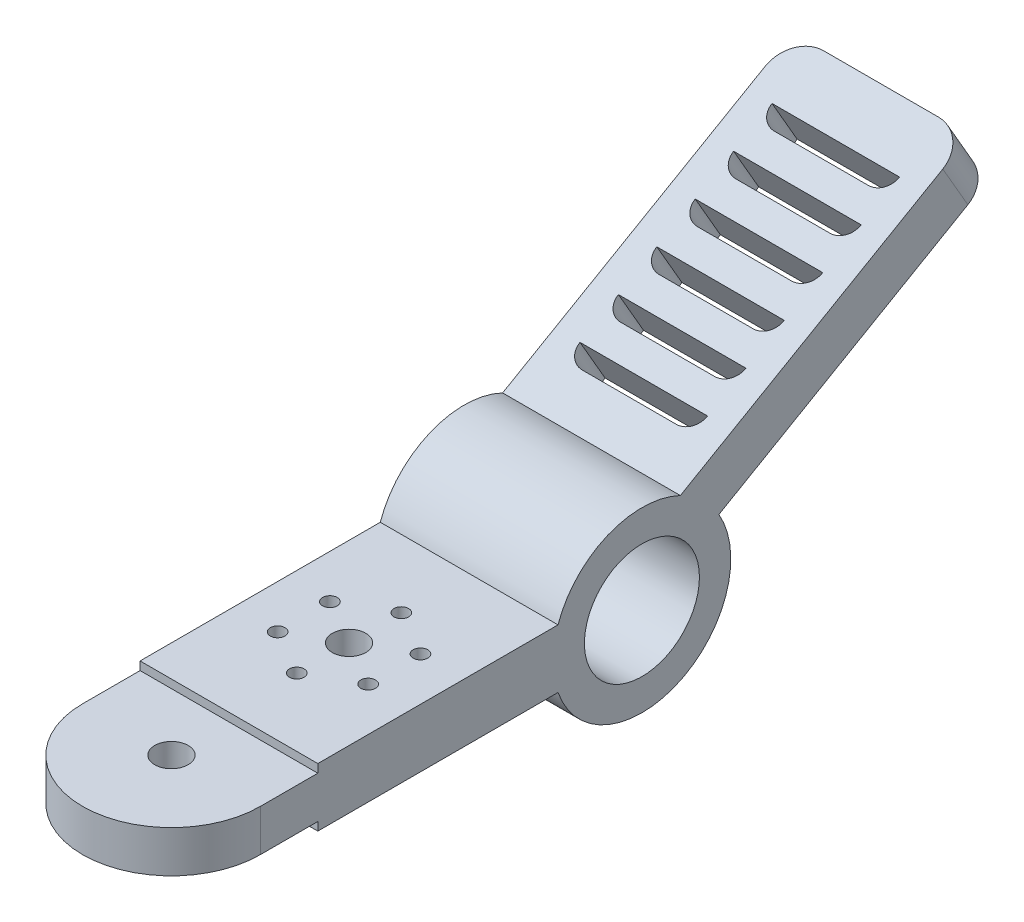
from build123d import *

# Parameters (mm, degrees)
BOSS_EXTRUDE1_DEPTH        = 85
F_16_0_55_DIAMETER_HOLE1_D = 55
CUT_EXTRUDE1_DEPTH         = 85
FILLET1_RADIUS             = 42.5
FILLET1_LENGTH             = 20
F_16_0_16_DIAMETER_HOLE1_D = 16
F_16_0_16_DIAMETER_HOLE2_D = 16
SKETCH9_R                  = 3.5
CUT_EXTRUDE2_DEPTH         = 85
FILLET2_R                  = 15


with BuildPart() as part:
    # Sketch1 → Boss-Extrude1 (new body)
    with BuildSketch(Plane(origin=(0, 0, 0), x_dir=(0, 0, -1), z_dir=(1, 0, 0))):
        with BuildLine():
            ThreePointArc((-40.127920454, -14), (-42.5, 0), (-40.127920454, 14))
            Line((-40.127920454, 14), (-155, 14))
            Line((-155, 14), (-155, 10))
            Line((-155, 10), (-225, 10))
            Line((-225, 10), (-225, -10))
            Line((-225, -10), (-155, -10))
            Line((-155, -10), (-155, -14))
            Line((-155, -14), (-40.127920454, -14))
        make_face()
        with BuildLine():
            Line((36.806079661, 21.25), (0, 0))
            Line((0, 0), (0, -10))
            Line((0, -10), (0, -14))
            Line((0, -14), (-40.127920454, -14))
            ThreePointArc((-40.127920454, -14), (7.099766922, -41.902784032), (42.5, 0))
            ThreePointArc((42.5, 0), (41.051847617, 10.999809417), (36.806079661, 21.25))
        make_face()
        with BuildLine():
            Line((0, -10), (0, 0))
            Line((0, 0), (-8.082903769, 14))
            Line((-8.082903769, 14), (-40.127920454, 14))
            ThreePointArc((-40.127920454, 14), (-42.5, 0), (-40.127920454, -14))
            Line((-40.127920454, -14), (0, -14))
            Line((0, -14), (0, -10))
        make_face()
        with BuildLine():
            Line((-40.127920454, 14), (-8.082903769, 14))
            Line((-8.082903769, 14), (-12, 20.784609691))
            Line((-12, 20.784609691), (18.375771595, 38.322069598))
            ThreePointArc((18.375771595, 38.322069598), (-16.315016469, 39.243728641), (-40.127920454, 14))
        make_face()
        Polygon((-8.082903769, 14), (0, 0), (0, 10), (0, 14), align=None)
        with BuildLine():
            Line((0, 10), (0, 0))
            Line((0, 0), (36.806079661, 21.25))
            ThreePointArc((36.806079661, 21.25), (28.88118881, 31.178950157), (18.375771595, 38.322069598))
            Line((18.375771595, 38.322069598), (-12, 20.784609691))
            Line((-12, 20.784609691), (-8.082903769, 14))
            Line((-8.082903769, 14), (0, 14))
            Line((0, 14), (0, 10))
        make_face()
        with BuildLine():
            ThreePointArc((18.375771595, 38.322069598), (28.88118881, 31.178950157), (36.806079661, 21.25))
            Line((36.806079661, 21.25), (168.874953738, 97.5))
            Line((168.874953738, 97.5), (156.874953738, 118.284609691))
            Line((156.874953738, 118.284609691), (18.375771595, 38.322069598))
        make_face()
    extrude(amount=BOSS_EXTRUDE1_DEPTH)

    # Ø16.0 (55) Diameter Hole1 (through all)
    with Locations(Plane(origin=(85, 0, 0), x_dir=(0, 0, 1), z_dir=(1, 0, 0))):
        with Locations((0, 0)):
            Hole(F_16_0_55_DIAMETER_HOLE1_D / 2)

    # Sketch3 → Cut-Extrude1 (cut)
    with BuildSketch(Plane(origin=(0, 20.784609691, 12), x_dir=(1, 0, 0), z_dir=(0, 0.8660254037844386, 0.5000000000000002))):
        with BuildLine():
            Line((73, 127.58), (12, 127.58))
            Line((12, 127.58), (12, 127.579))
            ThreePointArc((12, 127.579), (14.343145751, 121.922145751), (20, 119.579))
            Line((20, 119.579), (65, 119.579))
            ThreePointArc((65, 119.579), (70.656854249, 121.922145751), (73, 127.579))
            Line((73, 127.579), (73, 127.58))
        make_face()
        with BuildLine():
            ThreePointArc((73, 106.369), (70.656854249, 100.712145751), (65, 98.369))
            Line((65, 98.369), (20, 98.369))
            ThreePointArc((20, 98.369), (14.343145751, 100.712145751), (12, 106.369))
            Line((12, 106.369), (12, 106.37))
            Line((12, 106.37), (73, 106.37))
            Line((73, 106.37), (73, 106.369))
        make_face()
        with BuildLine():
            ThreePointArc((73, 85.159), (70.656854249, 79.502145751), (65, 77.159))
            Line((65, 77.159), (20, 77.159))
            ThreePointArc((20, 77.159), (14.343145751, 79.502145751), (12, 85.159))
            Line((12, 85.159), (12, 85.16))
            Line((12, 85.16), (73, 85.16))
            Line((73, 85.16), (73, 85.159))
        make_face()
        with BuildLine():
            Line((73, 63.95), (12, 63.95))
            Line((12, 63.95), (12, 63.949))
            ThreePointArc((12, 63.949), (14.343145751, 58.292145751), (20, 55.949))
            Line((20, 55.949), (65, 55.949))
            ThreePointArc((65, 55.949), (70.656854249, 58.292145751), (73, 63.949))
            Line((73, 63.949), (73, 63.95))
        make_face()
        with BuildLine():
            Line((12, 170), (73, 170))
            Line((73, 170), (73, 169.999))
            ThreePointArc((73, 169.999), (70.656854249, 164.342145751), (65, 161.999))
            Line((65, 161.999), (20, 161.999))
            ThreePointArc((20, 161.999), (14.343145751, 164.342145751), (12, 169.999))
            Line((12, 169.999), (12, 170))
        make_face()
        with BuildLine():
            Line((73, 148.79), (12, 148.79))
            Line((12, 148.79), (12, 148.789))
            ThreePointArc((12, 148.789), (14.343145751, 143.132145751), (20, 140.789))
            Line((20, 140.789), (65, 140.789))
            ThreePointArc((65, 140.789), (70.656854249, 143.132145751), (73, 148.789))
            Line((73, 148.789), (73, 148.79))
        make_face()
    extrude(amount=-CUT_EXTRUDE1_DEPTH, mode=Mode.SUBTRACT)

    # Fillet1: full round fillet: the end face becomes a half cylinder, R = half its width
    fillet1_face = Plane((42.5, 0, 225), x_dir=(0, -1, 0), z_dir=(0, 0, 1))  # on the end face: x along it, z out of the body
    fillet1_slab = fillet1_face.offset(-FILLET1_RADIUS / 2) * Box(FILLET1_LENGTH, 2 * FILLET1_RADIUS, FILLET1_RADIUS, mode=Mode.PRIVATE)  # the body's end, R deep
    fillet1_round = Plane((42.5, 0, 182.5), x_dir=(0, 0, 1), z_dir=(0, -1, 0)) * Cylinder(FILLET1_RADIUS, FILLET1_LENGTH, mode=Mode.PRIVATE)  # its axis R under the face
    add(fillet1_slab - fillet1_round, mode=Mode.SUBTRACT)

    # Ø16.0 (16) Diameter Hole1 (through all)
    with Locations(Plane(origin=(42.5, -10, 182.5), x_dir=(0, 0, -1), z_dir=(0, -1, 0))):
        with Locations((0, 0)):
            Hole(F_16_0_16_DIAMETER_HOLE1_D / 2)

    # Ø16.0 (16) Diameter Hole2 (through all)
    with Locations(Plane(origin=(42.5, 14, 97.563960227), x_dir=(0, 0, 1), z_dir=(0, 1, 0))):
        with Locations((0, 0)):
            Hole(F_16_0_16_DIAMETER_HOLE2_D / 2)

    # Sketch9 → Cut-Extrude2 (cut)
    with BuildSketch(Plane(origin=(0, 14, 0), x_dir=(1, 0, 0), z_dir=(0, 1, 0))):
        with Locations(Location((42.5, -72.563960227, 0), (0, 0, 270))):
            Circle(SKETCH9_R)
        with Locations(Location((64.150635095, -85.063960227, 0), (0, 0, 270))):
            Circle(SKETCH9_R)
        with Locations(Location((64.150635095, -110.063960227, 0), (0, 0, 270))):
            Circle(SKETCH9_R)
        with Locations(Location((42.5, -122.563960227, 0), (0, 0, 270))):
            Circle(SKETCH9_R)
        with Locations(Location((20.849364905, -110.063960227, 0), (0, 0, 270))):
            Circle(SKETCH9_R)
        with Locations(Location((20.849364905, -85.063960227, 0), (0, 0, 270))):
            Circle(SKETCH9_R)
    extrude(amount=-CUT_EXTRUDE2_DEPTH, mode=Mode.SUBTRACT)

    # Fillet2
    fillet2_edges = [part.edges().sort_by_distance(p)[0] for p in [
        (85, 107.892304845, -162.874953738),
        (0, 107.892304845, -162.874953738),
    ]]
    fillet(fillet2_edges, radius=FILLET2_R)


solid = part.part
